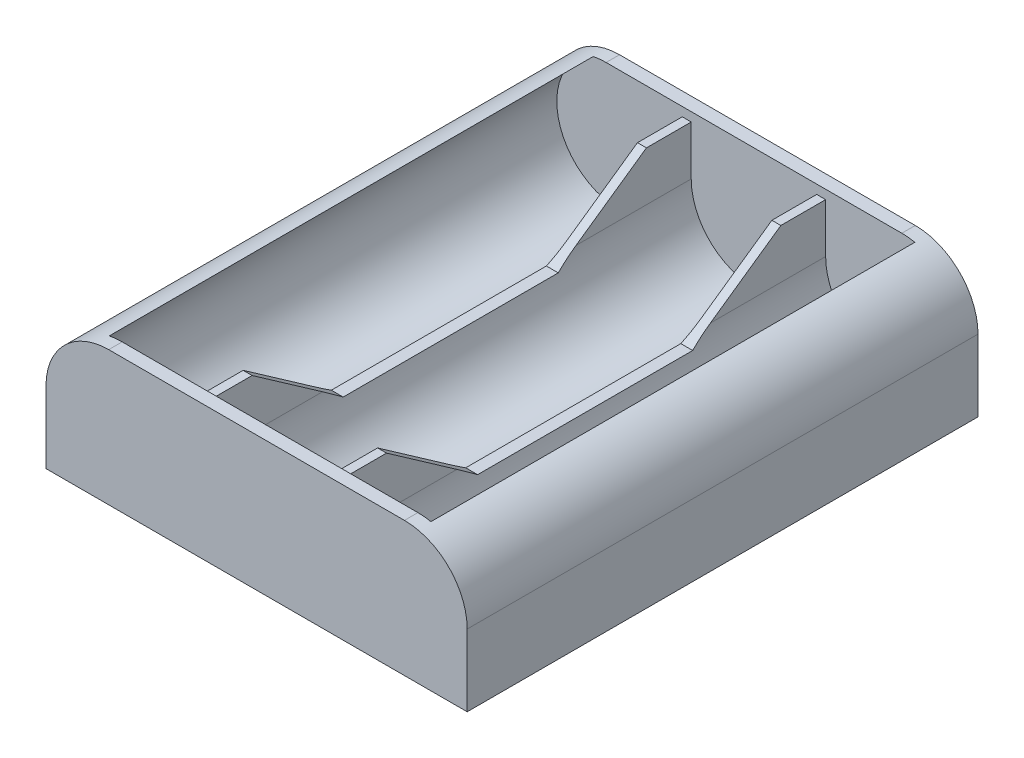
from build123d import *

# Parameters (mm, degrees)
SKETCH1_W           = 47
SKETCH1_H           = 55.5
BOSS_EXTRUDE1_DEPTH = 15
CUT_EXTRUDE4_DEPTH  = 54
FILLET1_R           = 7
FILLET2_R           = 7
SKETCH3_W           = 4.401923789
SKETCH3_H           = 6.5
CUT_EXTRUDE5_DEPTH  = 54
SKETCH4_W           = 1
SKETCH4_H           = 1
CUT_EXTRUDE6_DEPTH  = 54
CUT_EXTRUDE7_DEPTH  = 20
CUT_EXTRUDE8_DEPTH  = 5
BOSS_EXTRUDE3_DEPTH = 1.5


with BuildPart() as part:
    # Sketch1 → Boss-Extrude1 (new body)
    with BuildSketch(Plane(origin=(0, 0, 0), x_dir=(1, 0, 0), z_dir=(0, 1, 0))):
        with Locations((23.5, -27.75)):
            Rectangle(SKETCH1_W, SKETCH1_H)
    extrude(amount=BOSS_EXTRUDE1_DEPTH)

    # Sketch2 → Cut-Extrude4 (cut)
    with BuildSketch(Plane.XY.offset(55.5)):
        with BuildLine():
            Line((11.098076211, 15), (5.901923789, 15))
            ThreePointArc((5.901923789, 15), (8.5, 1.5), (11.098076211, 15))
        make_face()
        with BuildLine():
            Line((26.098076211, 15), (20.901923789, 15))
            ThreePointArc((20.901923789, 15), (23.5, 1.5), (26.098076211, 15))
        make_face()
        with BuildLine():
            ThreePointArc((35.901923789, 15), (38.5, 1.5), (41.098076211, 15))
            Line((41.098076211, 15), (35.901923789, 15))
        make_face()
    extrude(amount=-CUT_EXTRUDE4_DEPTH, mode=Mode.SUBTRACT)

    # Fillet1
    fillet1_edges = [part.edges().sort_by_distance(p)[0] for p in [
        (47, 15, 27.75),
    ]]
    fillet(fillet1_edges, radius=FILLET1_R)

    # Fillet2
    fillet2_edges = [part.edges().sort_by_distance(p)[0] for p in [
        (0, 15, 27.75),
    ]]
    fillet(fillet2_edges, radius=FILLET2_R)

    # Sketch3 → Cut-Extrude5 (cut)
    with BuildSketch(Plane.XY.offset(55.5)):
        with Locations((28.299038106, 11.75)):
            Rectangle(SKETCH3_W, SKETCH3_H)
        with Locations((33.700961895, 11.75)):
            Rectangle(SKETCH3_W, SKETCH3_H)
        with Locations((13.299038106, 11.75)):
            Rectangle(SKETCH3_W, SKETCH3_H)
        with Locations((18.700961895, 11.75)):
            Rectangle(SKETCH3_W, SKETCH3_H)
    extrude(amount=-CUT_EXTRUDE5_DEPTH, mode=Mode.SUBTRACT)

    # Sketch4 → Cut-Extrude6 (cut)
    with BuildSketch(Plane.XY.offset(55.5)):
        with Locations((16, 14.5)):
            Rectangle(SKETCH4_W, SKETCH4_H)
        with Locations((31, 14.5)):
            Rectangle(SKETCH4_W, SKETCH4_H)
    extrude(amount=-CUT_EXTRUDE6_DEPTH, mode=Mode.SUBTRACT)

    # Sketch5 → Cut-Extrude7 (cut)
    with BuildSketch(Plane.ZY.offset(-15.5)):
        Polygon((6.5, 14), (50.5, 14), (40.5, 7), (16.5, 7), align=None)
    extrude(amount=-CUT_EXTRUDE7_DEPTH, mode=Mode.SUBTRACT)

    # Sketch5<2> → Cut-Extrude8 (cut)
    with BuildSketch(Plane.ZY.offset(-15.5)):
        Polygon((6.5, 14), (50.5, 14), (40.5, 7), (16.5, 7), align=None)
    extrude(amount=CUT_EXTRUDE8_DEPTH, mode=Mode.SUBTRACT)

    # Sketch6 → Boss-Extrude3 (add)
    with BuildSketch(Plane.XY.offset(55.5)):
        with BuildLine():
            Line((0, 0), (47, 0))
            Line((47, 0), (47, 8))
            ThreePointArc((47, 8), (44.949747468, 12.949747468), (40, 15))
            Line((40, 15), (7, 15))
            ThreePointArc((7, 15), (2.050252532, 12.949747468), (0, 8))
            Line((0, 8), (0, 0))
        make_face()
    extrude(amount=BOSS_EXTRUDE3_DEPTH)


solid = part.part
